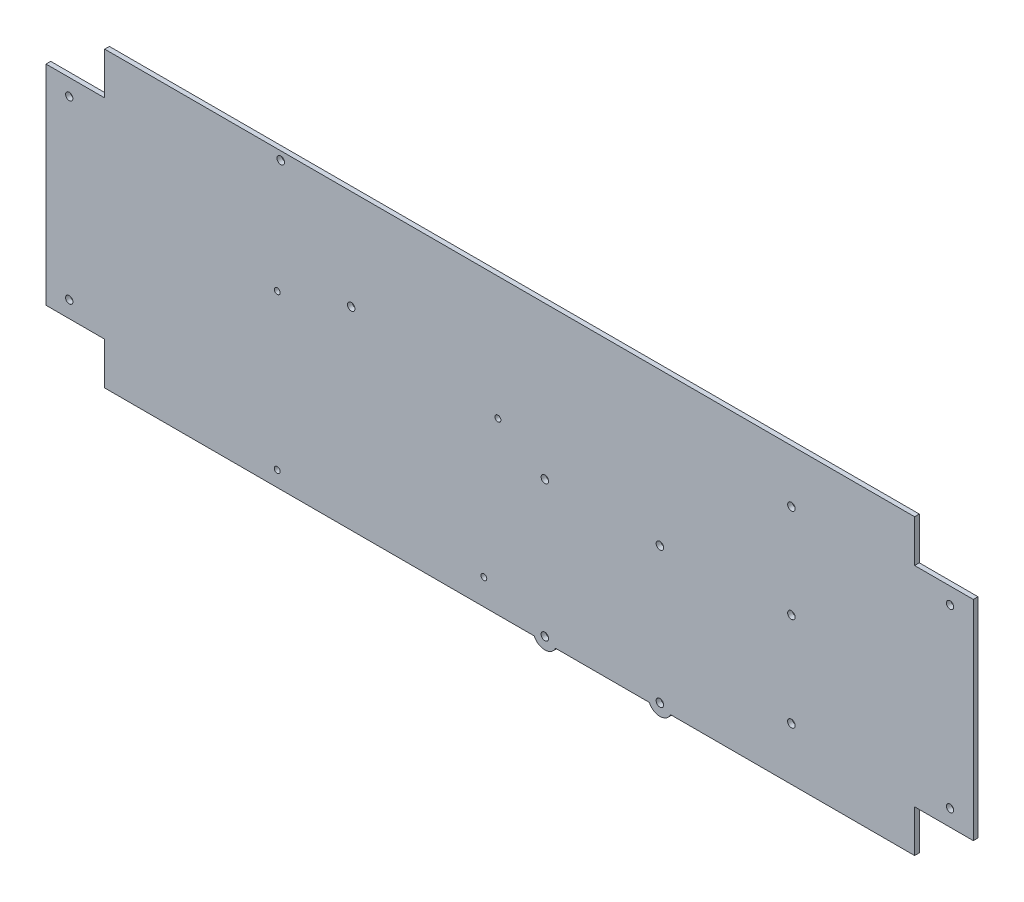
from build123d import *

# Parameters (mm, degrees)
SKETCH1_W               = 395
SKETCH1_H               = 125
BOSS_EXTRUDE1_DEPTH     = 2
SKETCH2_R               = 1.55
FIXING_HOLES_DEPTH      = 208.162979318
SKETCH3_W               = 25
SKETCH3_H               = 18
CUT_EXTRUDE2_DEPTH      = 208.162979318
MIRROR2_COPY_1_SKETCH_W = 25
MIRROR2_COPY_1_SKETCH_H = 18
MIRROR2_COPY_1_DEPTH    = 208.162979318
SKETCH4_R               = 1.25
CAVE_BOARD_HOLES_DEPTH  = 208.162979318
SKETCH5_R               = 1.6
RPI_HOLES_DEPTH         = 208.162979318
SKETCH6_R               = 1.6
BUZZER_HOLES_DEPTH      = 208.162979318
SKETCH7_R               = 1.6
RELAYS_HOLES_DEPTH      = 208.162979318
BOSS_EXTRUDE2_DEPTH     = 2


with BuildPart() as part:
    # Sketch1 → Boss-Extrude1 (new body)
    with BuildSketch(Plane.XY):
        Rectangle(SKETCH1_W, SKETCH1_H)
    extrude(amount=BOSS_EXTRUDE1_DEPTH)

    # Sketch2 → Fixing_holes (cut, through all)
    with BuildSketch(Plane.XY.offset(2)):
        with Locations((-187.6, 37.5)):
            Circle(SKETCH2_R)
        with Locations((-187.6, -37.5)):
            Circle(SKETCH2_R)
        with Locations((187.6, 37.5)):
            Circle(SKETCH2_R)
        with Locations((187.6, -37.5)):
            Circle(SKETCH2_R)
    extrude(amount=-FIXING_HOLES_DEPTH, mode=Mode.SUBTRACT)

    # Sketch3 → Cut-Extrude2 (cut, through all)
    with BuildSketch(Plane.XY.offset(2)):
        with Locations((-185, 53.5)):
            Rectangle(SKETCH3_W, SKETCH3_H)
    cut_extrude2 = extrude(amount=-CUT_EXTRUDE2_DEPTH, mode=Mode.SUBTRACT)

    # Mirror1: Cut-Extrude2 across plane
    add(cut_extrude2.mirror(Plane.ZX), mode=Mode.SUBTRACT)

    # Mirror2: Cut-Extrude2 across plane
    add(cut_extrude2.mirror(Plane(origin=(0, 0, 0), x_dir=(0, 0, 1), z_dir=(1, 0, 0))), mode=Mode.SUBTRACT)

    # Mirror2 copy 1 sketch → Mirror2 copy 1 (cut, through all)
    with BuildSketch(Plane(origin=(0, 0, 2), x_dir=(-1, 0, 0), z_dir=(0, 0, 1))):
        with Locations((-185, 53.5)):
            Rectangle(MIRROR2_COPY_1_SKETCH_W, MIRROR2_COPY_1_SKETCH_H)
    extrude(amount=-MIRROR2_COPY_1_DEPTH, mode=Mode.SUBTRACT)

    # Sketch4 → Cave_board_holes (cut, through all)
    with BuildSketch(Plane.XY.offset(2)):
        with Locations((-99, 10)):
            Circle(SKETCH4_R)
        with Locations((-99, -56)):
            Circle(SKETCH4_R)
        with Locations((-5, 10)):
            Circle(SKETCH4_R)
        with Locations((-11, -51.5)):
            Circle(SKETCH4_R)
    extrude(amount=-CAVE_BOARD_HOLES_DEPTH, mode=Mode.SUBTRACT)

    # Sketch5 → RPi_holes (cut, through all)
    with BuildSketch(Plane.XY.offset(2)):
        with Locations((15, -2.4)):
            Circle(SKETCH5_R)
        with Locations((15, -60.4)):
            Circle(SKETCH5_R)
        with Locations((64, -2.4)):
            Circle(SKETCH5_R)
        with Locations((64, -60.4)):
            Circle(SKETCH5_R)
    extrude(amount=-RPI_HOLES_DEPTH, mode=Mode.SUBTRACT)

    # Sketch6 → buzzer_holes (cut, through all)
    with BuildSketch(Plane.XY.offset(2)):
        with Locations((-97.5, 59)):
            Circle(SKETCH6_R)
        with Locations((-67.5, 20)):
            Circle(SKETCH6_R)
    extrude(amount=-BUZZER_HOLES_DEPTH, mode=Mode.SUBTRACT)

    # Sketch7 → relays_holes (cut, through all)
    with BuildSketch(Plane.XY.offset(2)):
        with Locations((120, 0)):
            Circle(SKETCH7_R)
        with Locations((120, 40)):
            Circle(SKETCH7_R)
        with Locations((120, -40)):
            Circle(SKETCH7_R)
    extrude(amount=-RELAYS_HOLES_DEPTH, mode=Mode.SUBTRACT)

    # Sketch8 → Boss-Extrude2 (add)
    with BuildSketch(Plane.XY.offset(2)):
        with BuildLine():
            Line((10.462379478, -62.5), (19.537620522, -62.5))
            ThreePointArc((19.537620522, -62.5), (15, -65.4), (10.462379478, -62.5))
        make_face()
        with BuildLine():
            Line((59.462379478, -62.5), (68.537620522, -62.5))
            ThreePointArc((68.537620522, -62.5), (64, -65.4), (59.462379478, -62.5))
        make_face()
    extrude(amount=-BOSS_EXTRUDE2_DEPTH)


solid = part.part
